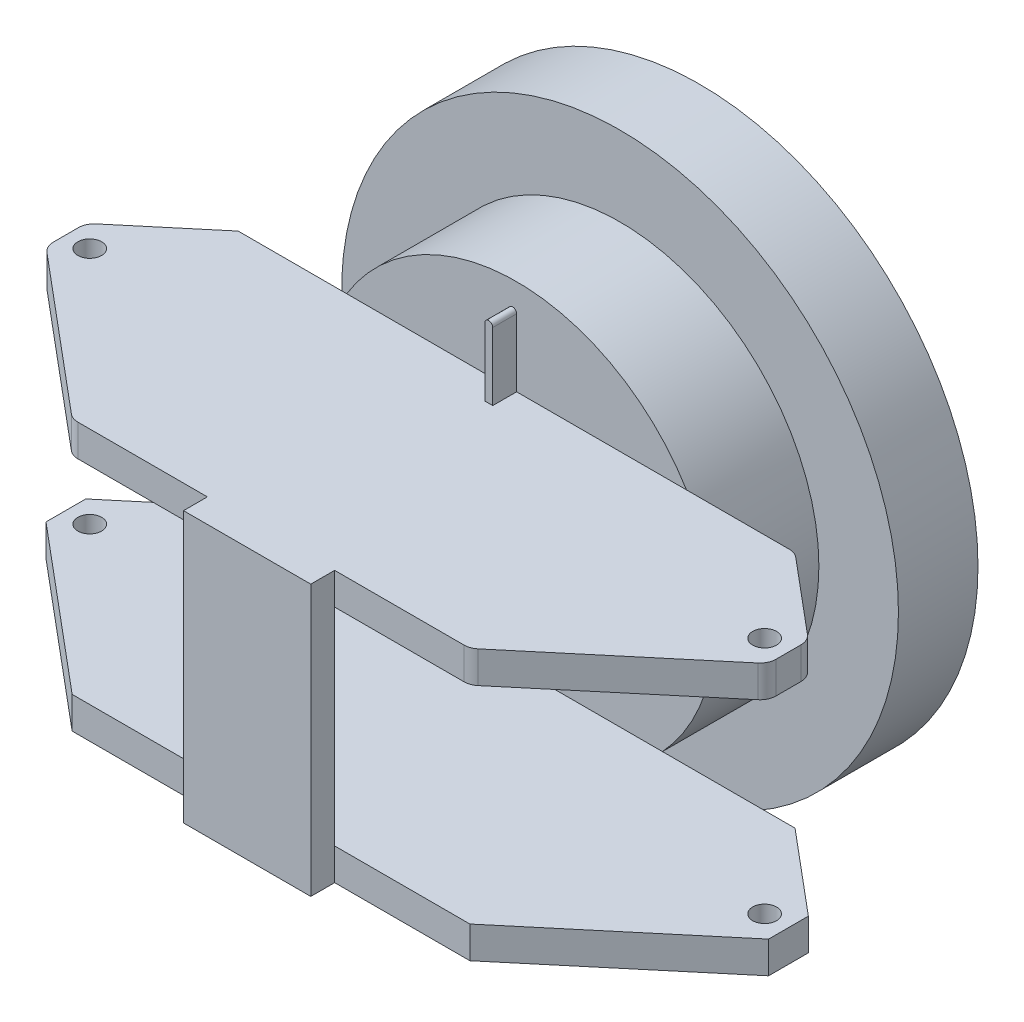
from build123d import *

# Parameters (mm, degrees)
SKETCH1_R                   = 35
BOSS_EXTRUDE1_DEPTH         = 10
SKETCH2_R                   = 25
BOSS_EXTRUDE2_DEPTH         = 13
SKETCH3_W                   = 25
SKETCH3_H                   = 30.873131111
BOSS_EXTRUDE3_DEPTH         = 4
FILLET1_R                   = 2
SKETCH4_R                   = 1.5
CUT_EXTRUDE1_DEPTH          = 4
MIRROR2_COPY_1_SKETCH_R     = 1.5
MIRROR2_COPY_1_DEPTH        = 4
SKETCH5_W                   = 1
SKETCH5_H                   = 9
BOSS_EXTRUDE4_DEPTH         = 3
FILLET2_RADIUS              = 0.5
FILLET2_LENGTH              = 3
FILLET2_OF_MIRROR3_2_RADIUS = 0.5
FILLET2_OF_MIRROR3_2_LENGTH = 3
SKETCH6_W                   = 16
SKETCH6_H                   = 42
BOSS_EXTRUDE5_DEPTH         = 3
SKETCH7_R                   = 10
CUT_EXTRUDE2_DEPTH          = 10
SKETCH9_W                   = 16
SKETCH9_H                   = 8
CUT_EXTRUDE4_DEPTH          = 10


with BuildPart() as part:
    # Sketch1 → Boss-Extrude1 (new body)
    with BuildSketch(Plane.XY):
        Circle(SKETCH1_R)
    extrude(amount=BOSS_EXTRUDE1_DEPTH)

    # Sketch2 → Boss-Extrude2 (add)
    with BuildSketch(Plane.XY.offset(10)):
        with Locations(Location((0, 0, 0), (0, 0, 180))):
            Circle(SKETCH2_R)
    extrude(amount=BOSS_EXTRUDE2_DEPTH)

    # Sketch3 → Boss-Extrude3 (add)
    with BuildSketch(Plane(origin=(0, 13, 0), x_dir=(1, 0, 0), z_dir=(0, 1, 0))):
        with Locations((12.5, -38.436565556)):
            Rectangle(SKETCH3_W, SKETCH3_H)
        with Locations((-12.5, -38.436565556)):
            Rectangle(SKETCH3_W, SKETCH3_H)
        Polygon((-25, -53.873131111), (-25, -23), (-35, -23), (-45.417198476, -31.741067399), (-45.417198476, -36.741067399), align=None)
        Polygon((45.417198476, -31.741067399), (35, -23), (25, -23), (25, -53.873131111), (45.417198476, -36.741067399), align=None)
    boss_extrude3 = extrude(amount=-BOSS_EXTRUDE3_DEPTH)

    # Fillet1
    fillet1_edges = [part.edges().sort_by_distance(p)[0] for p in [
        (25, 11, 53.873131111),
        (-25, 11, 53.873131111),
        (-45.417198476, 11, 36.741067399),
        (-45.417198476, 11, 31.741067399),
        (35, 11, 23),
        (45.417198476, 11, 31.741067399),
        (45.417198476, 11, 36.741067399),
    ]]
    fillet(fillet1_edges, radius=FILLET1_R)

    # Sketch4 → Cut-Extrude1 (cut)
    with BuildSketch(Plane(origin=(0, 13, 0), x_dir=(1, 0, 0), z_dir=(0, 1, 0))):
        with Locations(Location((-42.417198476, -34.241067399, 0), (0, 0, 270))):
            Circle(SKETCH4_R)
    cut_extrude1 = extrude(amount=-CUT_EXTRUDE1_DEPTH, mode=Mode.SUBTRACT)

    # Mirror1: Cut-Extrude1 across plane
    add(cut_extrude1.mirror(Plane(origin=(0, 0, 0), x_dir=(0, 0, 1), z_dir=(1, 0, 0))), mode=Mode.SUBTRACT)

    # Mirror2: Boss-Extrude3, Cut-Extrude1 across plane
    add(boss_extrude3.mirror(Plane(origin=(0, -4, 0), x_dir=(0, 0, 1), z_dir=(0, -1, 0))))
    add(cut_extrude1.mirror(Plane(origin=(0, -4, 0), x_dir=(0, 0, 1), z_dir=(0, -1, 0))), mode=Mode.SUBTRACT)

    # Mirror2 copy 1 sketch → Mirror2 copy 1 (cut)
    with BuildSketch(Plane(origin=(0, -21, 0), x_dir=(-1, 0, 0), z_dir=(0, -1, 0))):
        with Locations(Location((-42.417198476, -34.241067399, 0), (0, 0, 270))):
            Circle(MIRROR2_COPY_1_SKETCH_R)
    extrude(amount=-MIRROR2_COPY_1_DEPTH, mode=Mode.SUBTRACT)

    # Sketch5 → Boss-Extrude4 (add)
    with BuildSketch(Plane.XY.offset(23)):
        with Locations((-0.5, 17.5)):
            Rectangle(SKETCH5_W, SKETCH5_H)
    boss_extrude4 = extrude(amount=BOSS_EXTRUDE4_DEPTH)

    # Fillet2: full round fillet: the end face becomes a half cylinder, R = half its width
    fillet2_face = Plane((-0.5, 22, 24.5), x_dir=(0, 0, -1), z_dir=(0, 1, 0))  # on the end face: x along it, z out of the body
    fillet2_slab = fillet2_face.offset(-FILLET2_RADIUS / 2) * Box(FILLET2_LENGTH, 2 * FILLET2_RADIUS, FILLET2_RADIUS, mode=Mode.PRIVATE)  # the body's end, R deep
    fillet2_round = Plane((-0.5, 21.5, 24.5), x_dir=(0, 1, 0), z_dir=(0, 0, -1)) * Cylinder(FILLET2_RADIUS, FILLET2_LENGTH, mode=Mode.PRIVATE)  # its axis R under the face
    add(fillet2_slab - fillet2_round, mode=Mode.SUBTRACT)

    # Mirror3: Boss-Extrude4 across plane
    add(boss_extrude4.mirror(Plane(origin=(0, -4, 0), x_dir=(0, 0, 1), z_dir=(0, -1, 0))))

    # Fillet2 of Mirror3 2: full round fillet: the end face becomes a half cylinder, R = half its width
    fillet2_of_mirror3_2_face = Plane((-0.5, -30, 24.5), x_dir=(0, 0, -1), z_dir=(0, -1, 0))  # on the end face: x along it, z out of the body
    fillet2_of_mirror3_2_slab = fillet2_of_mirror3_2_face.offset(-FILLET2_OF_MIRROR3_2_RADIUS / 2) * Box(FILLET2_OF_MIRROR3_2_LENGTH, 2 * FILLET2_OF_MIRROR3_2_RADIUS, FILLET2_OF_MIRROR3_2_RADIUS, mode=Mode.PRIVATE)  # the body's end, R deep
    fillet2_of_mirror3_2_round = Plane((-0.5, -29.5, 24.5), x_dir=(0, -1, 0), z_dir=(0, 0, -1)) * Cylinder(FILLET2_OF_MIRROR3_2_RADIUS, FILLET2_OF_MIRROR3_2_LENGTH, mode=Mode.PRIVATE)  # its axis R under the face
    add(fillet2_of_mirror3_2_slab - fillet2_of_mirror3_2_round, mode=Mode.SUBTRACT)

    # Sketch6 → Boss-Extrude5 (add)
    with BuildSketch(Plane.XY.offset(53.873131111)):
        Rectangle(SKETCH6_W, SKETCH6_H)
    extrude(amount=BOSS_EXTRUDE5_DEPTH)

    # Sketch7 → Cut-Extrude2 (cut)
    with BuildSketch(Plane(origin=(0, 0, 0), x_dir=(-1, 0, 0), z_dir=(0, 0, -1))):
        Circle(SKETCH7_R)
    extrude(amount=-CUT_EXTRUDE2_DEPTH, mode=Mode.SUBTRACT)

    # Sketch9 → Cut-Extrude4 (cut)
    with BuildSketch(Plane.XY.offset(56.873131111)):
        with Locations((0, 17)):
            Rectangle(SKETCH9_W, SKETCH9_H)
    extrude(amount=-CUT_EXTRUDE4_DEPTH, mode=Mode.SUBTRACT)


solid = part.part
